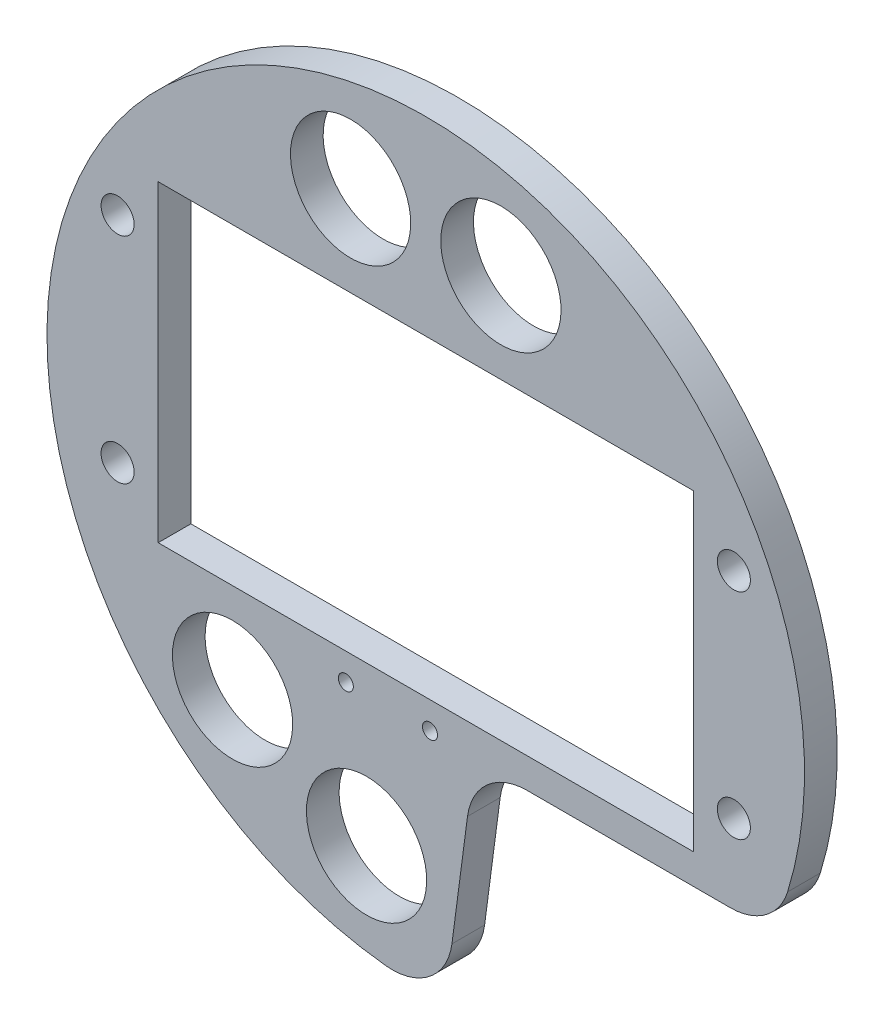
from build123d import *

# Parameters (mm, degrees)
SKETCH2_R           = 10
SKETCH2_R_2         = 2.75
SKETCH2_R_3         = 1.25
SKETCH2_W           = 89
SKETCH2_H           = 52
BOSS_EXTRUDE1_DEPTH = 5.4356


with BuildPart() as part:
    # Sketch2 → Boss-Extrude1 (new body)
    with BuildSketch(Plane(origin=(0, 0, -110.625), x_dir=(-1, 0, 0), z_dir=(0, 0, -1))):
        with BuildLine():
            Line((-4.357448371, -54.013133709), (-6.946028661, -34.350914325))
            ThreePointArc((-6.946028661, -34.350914325), (-10.267019124, -28.137778173), (-16.860477275, -25.656176248))
            Line((-16.860477275, -25.656176248), (-50.634811595, -25.656176248))
            ThreePointArc((-50.634811595, -25.656176248), (-56.570299984, -23.704155969), (-60.188549632, -18.610171766))
            ThreePointArc((-60.188549632, -18.610171766), (34.680301225, 52.595405759), (6.605490855, -62.652753256))
            ThreePointArc((6.605490855, -62.652753256), (-0.632673359, -60.562038878), (-4.357448371, -54.013133709))
        make_face()
        with Locations(Location((12.5, 46.343823752, 0), (0, 0, 90))):
            Circle(SKETCH2_R, mode=Mode.SUBTRACT)
        with Locations(Location((-12.5, 46.343823752, 0), (0, 0, 90))):
            Circle(SKETCH2_R, mode=Mode.SUBTRACT)
        with Locations(Location((32.134671235, -35.656176248, 0), (0, 0, 90))):
            Circle(SKETCH2_R, mode=Mode.SUBTRACT)
        with Locations(Location((9.845967479, -46.979324435, 0), (0, 0, 90))):
            Circle(SKETCH2_R, mode=Mode.SUBTRACT)
        with Locations(Location((51.25, 23.184046239, 0), (0, 0, 90))):
            Circle(SKETCH2_R_2, mode=Mode.SUBTRACT)
        with Locations(Location((51.25, -12.496398734, 0), (0, 0, 90))):
            Circle(SKETCH2_R_2, mode=Mode.SUBTRACT)
        with Locations(Location((-51.25, -12.496398734, 0), (0, 0, 90))):
            Circle(SKETCH2_R_2, mode=Mode.SUBTRACT)
        with Locations(Location((-51.25, 23.184046239, 0), (0, 0, 90))):
            Circle(SKETCH2_R_2, mode=Mode.SUBTRACT)
        with Locations(Location((13.291416771, -25.156176248, 0), (0, 0, 90))):
            Circle(SKETCH2_R_3, mode=Mode.SUBTRACT)
        with Locations(Location((-0.708583229, -25.156176248, 0), (0, 0, 90))):
            Circle(SKETCH2_R_3, mode=Mode.SUBTRACT)
        with Locations((0, 5.343823752)):
            Rectangle(SKETCH2_W, SKETCH2_H, mode=Mode.SUBTRACT)
    extrude(amount=-BOSS_EXTRUDE1_DEPTH)


solid = part.part
